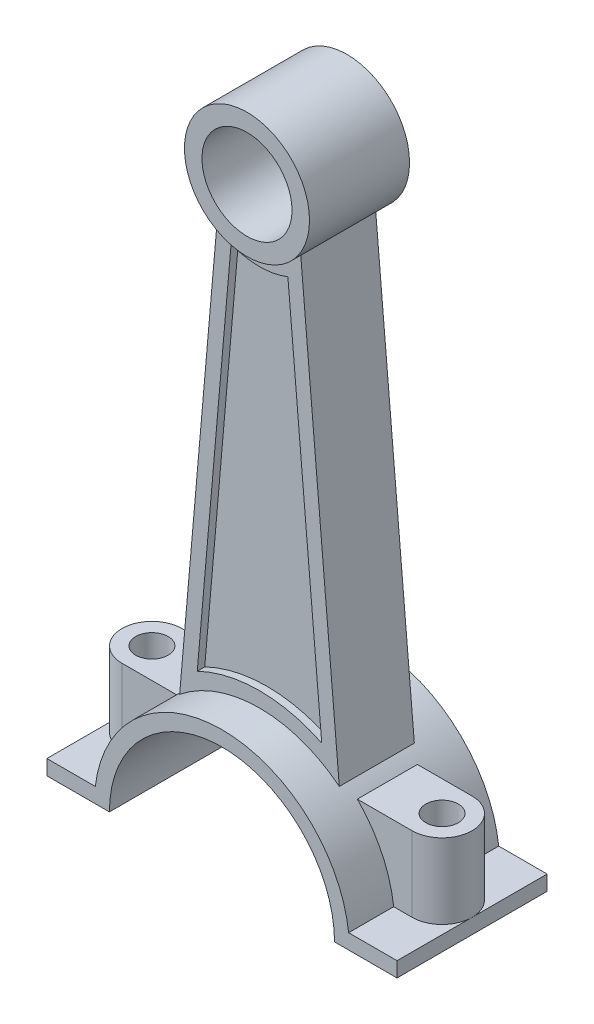
from build123d import *

# Parameters (mm, degrees)
BOSS_EXTRUDE3_DEPTH = 15
BOSS_EXTRUDE4_DEPTH = 6
BOSS_EXTRUDE5_DEPTH = 7.5
SKETCH1_8_R         = 12.5
SKETCH1_8_R_2       = 9
BOSS_EXTRUDE6_DEPTH = 10
CUT_EXTRUDE2_DEPTH  = 15
SKETCH3_7_R         = 3.25
CUT_EXTRUDE3_DEPTH  = 119.201565133
CUT_EXTRUDE5_DEPTH  = 1.5
CUT_EXTRUDE6_START  = -1.5
CUT_EXTRUDE6_DEPTH  = 1.5


with BuildPart() as part:
    # Sketch1 → Boss-Extrude3 (new, symmetric)
    with BuildSketch(Plane.XY):
        with BuildLine():
            Line((-25.322914524, -114.4), (-35, -114.4))
            Line((-35, -114.4), (-35, -117.4))
            Line((-35, -117.4), (-22.5, -117.4))
            ThreePointArc((-22.5, -117.4), (0, -94.9), (22.5, -117.4))
            Line((22.5, -117.4), (35, -117.4))
            Line((35, -117.4), (35, -114.4))
            Line((35, -114.4), (25.322914524, -114.4))
            ThreePointArc((25.322914524, -114.4), (0, -91.9), (-25.322914524, -114.4))
        make_face()
    extrude(amount=BOSS_EXTRUDE3_DEPTH, both=True)

    # Sketch1<6> → Boss-Extrude4 (add, symmetric)
    with BuildSketch(Plane.XY):
        with BuildLine():
            ThreePointArc((-25.322914524, -114.4), (-22.95258597, -106.290148637), (-18.062391868, -99.4))
            Line((-18.062391868, -99.4), (-35, -99.4))
            Line((-35, -99.4), (-35, -114.4))
            Line((-35, -114.4), (-25.322914524, -114.4))
        make_face()
        with BuildLine():
            ThreePointArc((18.062391868, -99.4), (22.95258597, -106.290148637), (25.322914524, -114.4))
            Line((25.322914524, -114.4), (35, -114.4))
            Line((35, -114.4), (35, -99.4))
            Line((35, -99.4), (18.062391868, -99.4))
        make_face()
    extrude(amount=BOSS_EXTRUDE4_DEPTH, both=True)

    # Sketch1<7> → Boss-Extrude5 (add, symmetric)
    with BuildSketch(Plane.XY):
        with BuildLine():
            Line((-8.248094724, -9.392493462), (-15.957377604, -97.51))
            ThreePointArc((-15.957377604, -97.51), (0, -91.9), (15.957377604, -97.51))
            Line((15.957377604, -97.51), (8.248094724, -9.392493462))
            ThreePointArc((8.248094724, -9.392493462), (0, -12.5), (-8.248094724, -9.392493462))
        make_face()
    extrude(amount=BOSS_EXTRUDE5_DEPTH, both=True)

    # Sketch1<8> → Boss-Extrude6 (add, symmetric)
    with BuildSketch(Plane.XY):
        Circle(SKETCH1_8_R)
        Circle(SKETCH1_8_R_2, mode=Mode.SUBTRACT)
    extrude(amount=BOSS_EXTRUDE6_DEPTH, both=True)

    # Sketch3 → Cut-Extrude2 (cut)
    with BuildSketch(Plane(origin=(0, -99.4, 0), x_dir=(1, 0, 0), z_dir=(0, 1, 0))):
        with BuildLine():
            Line((35, 6), (29, 6))
            ThreePointArc((29, 6), (33.242640687, 4.242640687), (35, 0))
            Line((35, 0), (35, 6))
        make_face()
        with BuildLine():
            ThreePointArc((35, 0), (33.242640687, -4.242640687), (29, -6))
            Line((29, -6), (35, -6))
            Line((35, -6), (35, 0))
        make_face()
        with BuildLine():
            Line((-35, 0), (-35, -6))
            Line((-35, -6), (-29, -6))
            ThreePointArc((-29, -6), (-33.242640687, -4.242640687), (-35, 0))
        make_face()
        with BuildLine():
            Line((-35, 6), (-35, 0))
            ThreePointArc((-35, 0), (-33.242640687, 4.242640687), (-29, 6))
            Line((-29, 6), (-35, 6))
        make_face()
    extrude(amount=-CUT_EXTRUDE2_DEPTH, mode=Mode.SUBTRACT)

    # Sketch3<7> → Cut-Extrude3 (cut, through all)
    with BuildSketch(Plane(origin=(0, -99.4, 0), x_dir=(1, 0, 0), z_dir=(0, 1, 0))):
        with Locations((29, 0)):
            Circle(SKETCH3_7_R)
        with Locations((-29, 0)):
            Circle(SKETCH3_7_R)
    extrude(amount=-CUT_EXTRUDE3_DEPTH, mode=Mode.SUBTRACT)

    # Sketch4 → Cut-Extrude5 (cut)
    with BuildSketch(Plane.XY.offset(7.5)):
        with BuildLine():
            Line((5.676752222, -14.423053914), (12.442830342, -91.759680714))
            ThreePointArc((12.442830342, -91.759680714), (0, -88.9), (-12.442830342, -91.759680714))
            Line((-12.442830342, -91.759680714), (-5.676752222, -14.423053914))
            ThreePointArc((-5.676752222, -14.423053914), (0, -15.5), (5.676752222, -14.423053914))
        make_face()
    extrude(amount=-CUT_EXTRUDE5_DEPTH, mode=Mode.SUBTRACT)

    # Sketch6 → Cut-Extrude6 (cut)
    with BuildSketch(Plane(origin=(0, 0, -7.5), x_dir=(-1, 0, 0), z_dir=(0, 0, -1)).offset(CUT_EXTRUDE6_START)):
        with BuildLine():
            Line((5.676752222, -14.423053914), (12.442830342, -91.759680714))
            ThreePointArc((12.442830342, -91.759680714), (0, -88.9), (-12.442830342, -91.759680714))
            Line((-12.442830342, -91.759680714), (-5.676752222, -14.423053914))
            ThreePointArc((-5.676752222, -14.423053914), (0, -15.5), (5.676752222, -14.423053914))
        make_face()
    extrude(amount=CUT_EXTRUDE6_DEPTH, mode=Mode.SUBTRACT)


solid = part.part
